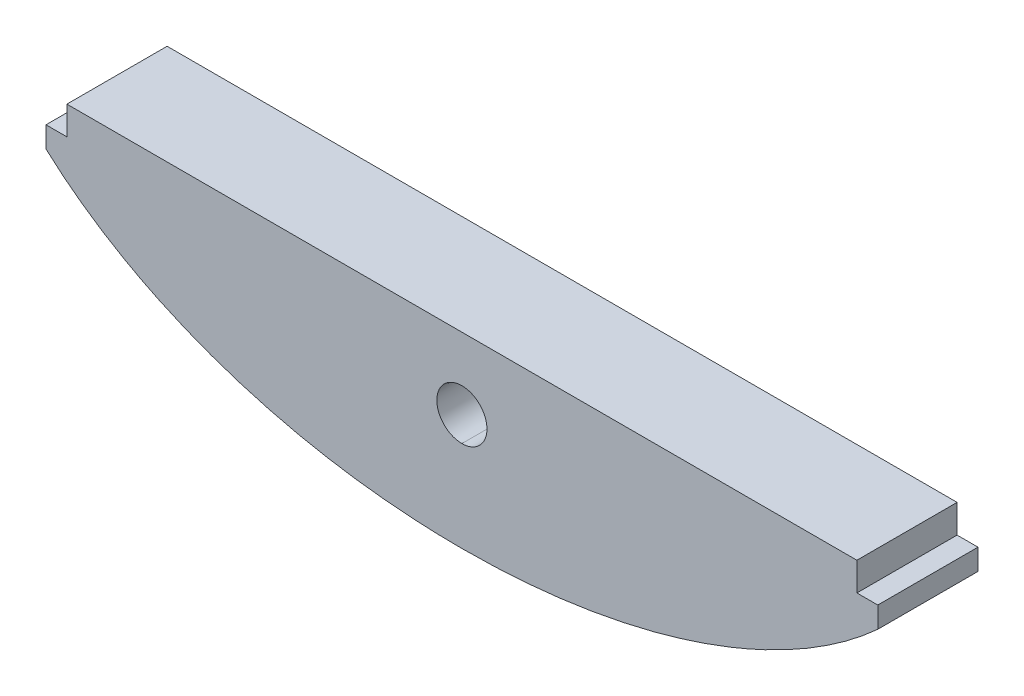
from build123d import *

# Parameters (mm, degrees)
EXTRUDE_1_DEPTH = 10


with BuildPart() as part:
    # 草图1 → 凸台-拉伸1 (new body)
    with BuildSketch(Plane.XY):
        with BuildLine():
            Line((15.08818867, 1.586238016), (15.08818867, 4.415501152))
            Line((15.08818867, 4.415501152), (-63.743519752, 4.415501152))
            Line((-63.743519752, 4.415501152), (-63.743519752, 1.586238016))
            Line((-63.743519752, 1.586238016), (-65.828448476, 1.586238016))
            Line((-65.828448476, 1.586238016), (-65.828448476, -0.512794067))
            add(Edge.make_bspline(
                [(-65.828448476, -0.512794067), (-62.716945893, -3.356182094), (-58.896356532, -5.860917235), (-54.525434698, -7.931721067)],
                knots=[5, 5, 5, 5, 6, 6, 6, 6], degree=3))
            add(Edge.make_bspline(
                [(-54.525434698, -7.931721067), (-46.10816209, -11.921636872), (-35.651823592, -14.281721066), (-24.327665541, -14.281721066)],
                knots=[6, 6, 6, 6, 7, 7, 7, 7], degree=3))
            add(Edge.make_bspline(
                [(-24.327665541, -14.281721066), (-13.00350749, -14.281721066), (-2.547168991, -11.921636872), (5.870103617, -7.931721067)],
                knots=[7, 7, 7, 7, 8, 8, 8, 8], degree=3))
            add(Edge.make_bspline(
                [(5.870103617, -7.931721067), (10.24102545, -5.860917235), (14.061614811, -3.356182094), (17.173117394, -0.512794067)],
                knots=[8, 8, 8, 8, 9, 9, 9, 9], degree=3))
            Line((17.173117394, -0.512794067), (17.173117394, 1.586238016))
            Line((17.173117394, 1.586238016), (15.08818867, 1.586238016))
        make_face()
        with BuildLine():
            add(Edge.make_bspline(
                [(-24.327665541, -5.21179665), (-25.707038709, -5.21179665), (-26.828869459, -4.093497123), (-26.828869459, -2.710614264), (-26.828869459, -1.331241095), (-25.707038709, -0.209410346), (-24.327665541, -0.209410346)],
                knots=[2, 2, 2, 2, 3, 3, 3, 4, 4, 4, 4], degree=3))
            add(Edge.make_bspline(
                [(-24.327665541, -0.209410346), (-22.948313904, -0.209410346), (-21.826483155, -1.331241095), (-21.826483155, -2.710614264), (-21.826483155, -4.093497123), (-22.948313904, -5.21179665), (-24.327665541, -5.21179665)],
                knots=[0, 0, 0, 0, 1, 1, 1, 2, 2, 2, 2], degree=3))
        make_face(mode=Mode.SUBTRACT)
    extrude(amount=EXTRUDE_1_DEPTH)


solid = part.part
